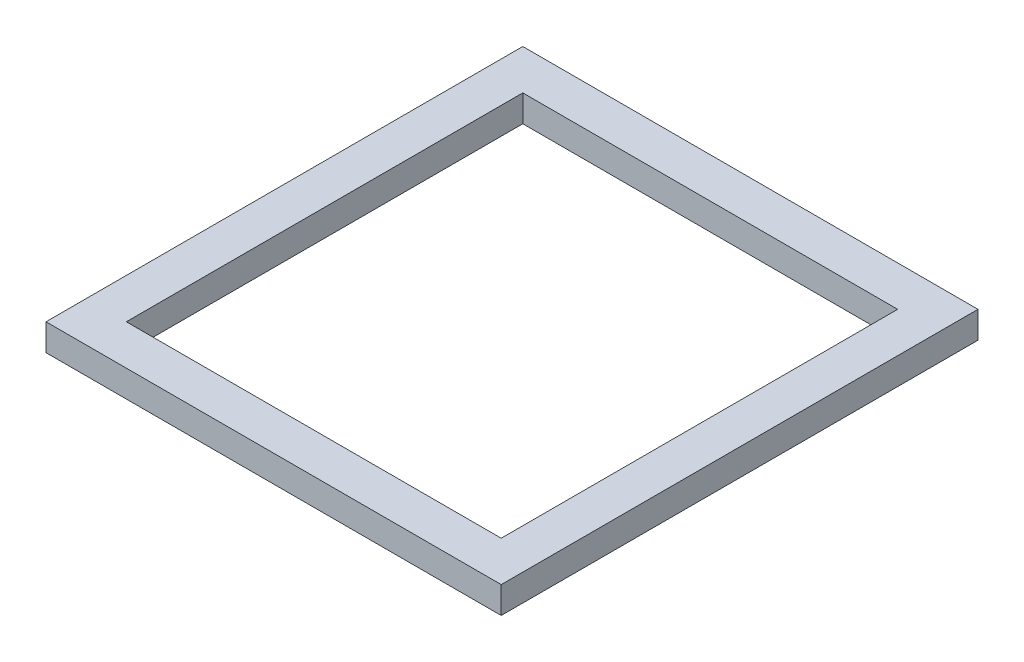
from build123d import *

# Parameters (mm, degrees)
SKETCH1_W           = 26.9875
SKETCH1_H           = 28.2675
SKETCH1_W_2         = 22.225
SKETCH1_H_2         = 23.505
BOSS_EXTRUDE1_DEPTH = 1.5875


with BuildPart() as part:
    # Sketch1 → Boss-Extrude1 (new body)
    with BuildSketch(Plane(origin=(0, 0, 0), x_dir=(1, 0, 0), z_dir=(0, 1, 0))):
        with Locations((13.49375, 14.13375)):
            Rectangle(SKETCH1_W, SKETCH1_H)
        with Locations((13.49375, 14.13375)):
            Rectangle(SKETCH1_W_2, SKETCH1_H_2, mode=Mode.SUBTRACT)
    extrude(amount=BOSS_EXTRUDE1_DEPTH)


solid = part.part
